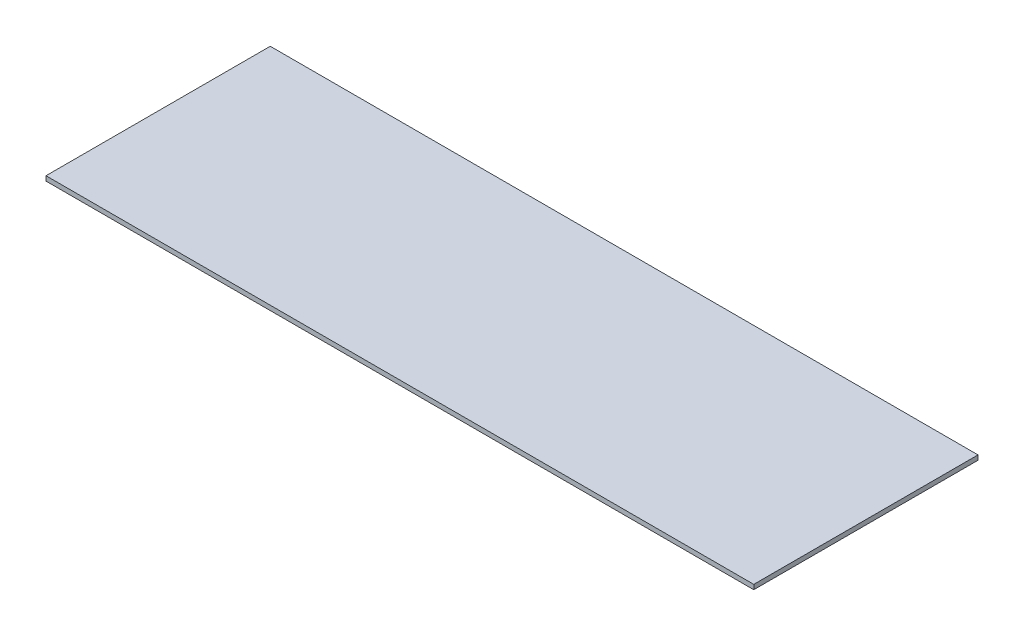
from build123d import *

# Parameters (mm, degrees)
SKETCH1_W           = 481.0125
SKETCH1_H           = 152.4
BOSS_EXTRUDE1_DEPTH = 3.175


with BuildPart() as part:
    # Sketch1 → Boss-Extrude1 (new body)
    with BuildSketch(Plane(origin=(0, 0, 0), x_dir=(1, 0, 0), z_dir=(0, 1, 0))):
        Rectangle(SKETCH1_W, SKETCH1_H)
    extrude(amount=BOSS_EXTRUDE1_DEPTH)


solid = part.part
